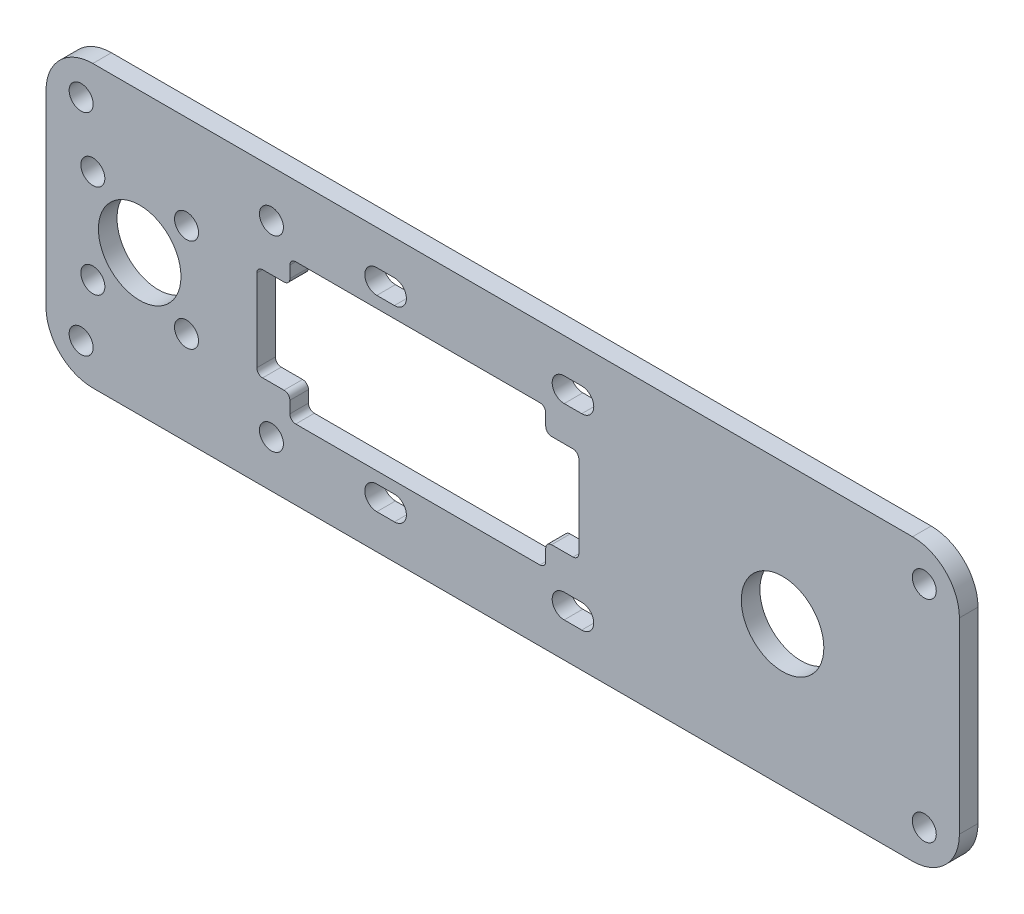
from build123d import *

# Parameters (mm, degrees)
SKETCH2_W           = 156
SKETCH2_H           = 48
SKETCH2_R           = 2.05
SKETCH2_R_2         = 7.05
BOSS_EXTRUDE2_DEPTH = 3.175
FILLET1_R           = 8
FILLET2_R           = 1


with BuildPart() as part:
    # Sketch2 → Boss-Extrude2 (new body)
    with BuildSketch(Plane.XY):
        Rectangle(SKETCH2_W, SKETCH2_H)
        with Locations((-70, 8)):
            Circle(SKETCH2_R, mode=Mode.SUBTRACT)
        with Locations((-54, 8)):
            Circle(SKETCH2_R, mode=Mode.SUBTRACT)
        with Locations((-54, -8)):
            Circle(SKETCH2_R, mode=Mode.SUBTRACT)
        with Locations((-70, -8)):
            Circle(SKETCH2_R, mode=Mode.SUBTRACT)
        with Locations((-39.5, 16)):
            Circle(SKETCH2_R, mode=Mode.SUBTRACT)
        with Locations((-39.5, -16)):
            Circle(SKETCH2_R, mode=Mode.SUBTRACT)
        with Locations((47.795580316, 0)):
            Circle(SKETCH2_R_2, mode=Mode.SUBTRACT)
        with Locations((-62, 0)):
            Circle(SKETCH2_R_2, mode=Mode.SUBTRACT)
        with Locations((72, 18)):
            Circle(SKETCH2_R, mode=Mode.SUBTRACT)
        with Locations((72, -18)):
            Circle(SKETCH2_R, mode=Mode.SUBTRACT)
        with Locations((-72, -18)):
            Circle(SKETCH2_R, mode=Mode.SUBTRACT)
        with Locations((-72, 18)):
            Circle(SKETCH2_R, mode=Mode.SUBTRACT)
        Polygon((7.35, -12), (-36.35, -12), (-36.35, -8), (-42, -8), (-42, 8), (-36.35, 8), (-36.35, 12), (7.35, 12), (7.35, 8), (13, 8), (13, -8), (7.35, -8), align=None, mode=Mode.SUBTRACT)
        with BuildLine():
            Line((10.5, 18.05), (13.5, 18.05))
            ThreePointArc((13.5, 18.05), (15.55, 16), (13.5, 13.95))
            Line((13.5, 13.95), (10.5, 13.95))
            ThreePointArc((10.5, 13.95), (8.45, 16), (10.5, 18.05))
        make_face(mode=Mode.SUBTRACT)
        with BuildLine():
            Line((-21.5, 13.95), (-18.5, 13.95))
            ThreePointArc((-18.5, 13.95), (-16.45, 16), (-18.5, 18.05))
            Line((-18.5, 18.05), (-21.5, 18.05))
            ThreePointArc((-21.5, 18.05), (-23.55, 16), (-21.5, 13.95))
        make_face(mode=Mode.SUBTRACT)
        with BuildLine():
            Line((-21.5, -18.05), (-18.5, -18.05))
            ThreePointArc((-18.5, -18.05), (-16.45, -16), (-18.5, -13.95))
            Line((-18.5, -13.95), (-21.5, -13.95))
            ThreePointArc((-21.5, -13.95), (-23.55, -16), (-21.5, -18.05))
        make_face(mode=Mode.SUBTRACT)
        with BuildLine():
            Line((10.5, -18.05), (13.5, -18.05))
            ThreePointArc((13.5, -18.05), (15.55, -16), (13.5, -13.95))
            Line((13.5, -13.95), (10.5, -13.95))
            ThreePointArc((10.5, -13.95), (8.45, -16), (10.5, -18.05))
        make_face(mode=Mode.SUBTRACT)
    extrude(amount=BOSS_EXTRUDE2_DEPTH)

    # Fillet1
    fillet1_edges = [part.edges().sort_by_distance(p)[0] for p in [
        (78, 24, 1.5875),
        (78, -24, 1.5875),
        (-78, -24, 1.5875),
        (-78, 24, 1.5875),
    ]]
    fillet(fillet1_edges, radius=FILLET1_R)

    # Fillet2
    fillet2_edges = [part.edges().sort_by_distance(p)[0] for p in [
        (7.35, 12, 1.5875),
        (-36.35, 12, 1.5875),
        (-36.35, 8, 1.5875),
        (-42, 8, 1.5875),
        (-42, -8, 1.5875),
        (-36.35, -8, 1.5875),
        (-36.35, -12, 1.5875),
        (7.35, -12, 1.5875),
        (7.35, -8, 1.5875),
        (13, -8, 1.5875),
        (13, 8, 1.5875),
        (7.35, 8, 1.5875),
    ]]
    fillet(fillet2_edges, radius=FILLET2_R)


solid = part.part
